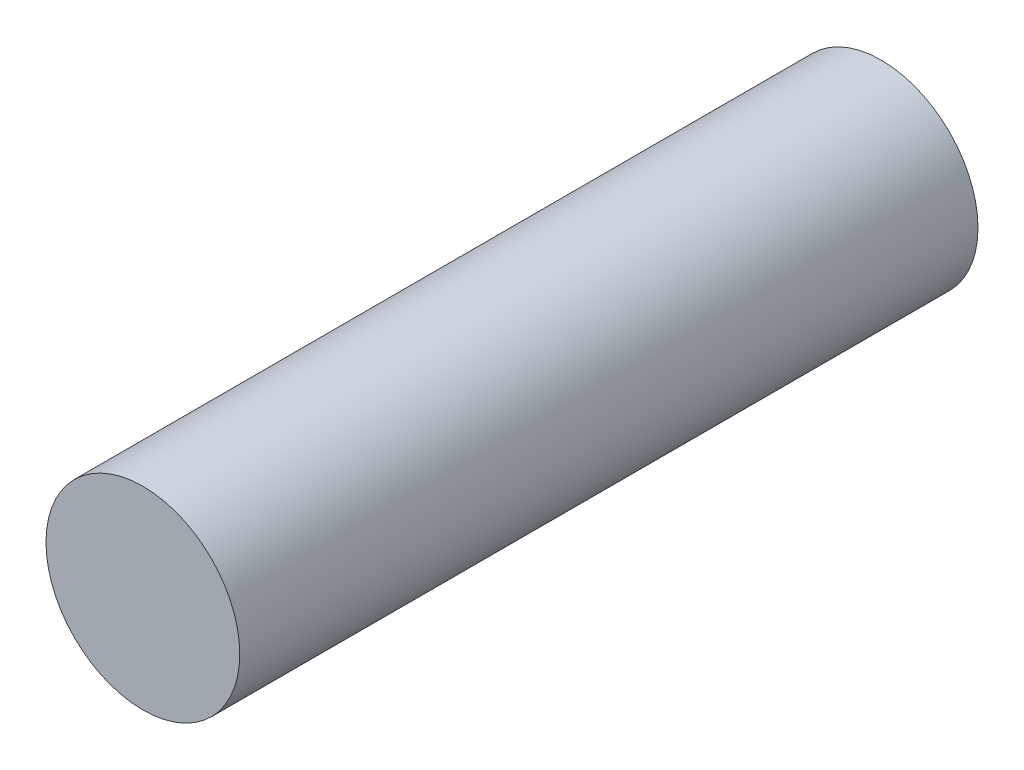
from build123d import *

# Parameters (mm, degrees)
SKETCH1_R           = 2.5
BOSS_EXTRUDE1_DEPTH = 19.05


with BuildPart() as part:
    # Sketch1 → Boss-Extrude1 (new body)
    with BuildSketch(Plane.XY):
        with Locations(Location((0, 0, 0), (0, 0, 180))):
            Circle(SKETCH1_R)
    extrude(amount=BOSS_EXTRUDE1_DEPTH)


solid = part.part
